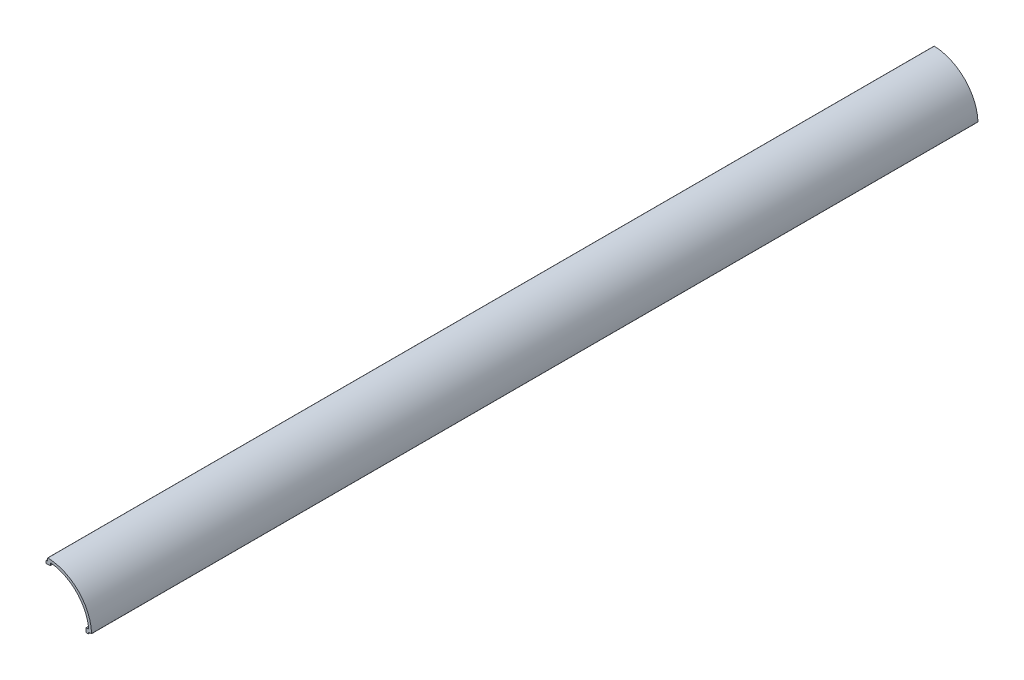
from build123d import *

# Parameters (mm, degrees)
EXTRUDE_THIN1_DEPTH = 150
FILLET1_R           = 0.1


with BuildPart() as part:
    # Sketch1 → Extrude-Thin1 (new, symmetric)
    with BuildSketch(Plane.XY):
        with BuildLine():
            Line((14.416629547, 0), (14.416629547, 0.55))
            Line((14.416629547, 0.55), (15.440207252, 0.55))
            ThreePointArc((15.440207252, 0.55), (10.924799769, 10.924799769), (0.55, 15.440207252))
            Line((0.55, 15.440207252), (0.55, 14.416629547))
            Line((0.55, 14.416629547), (0, 14.416629547))
            Line((0, 14.416629547), (0, 13.516629547))
            Line((0, 13.516629547), (1.45, 13.516629547))
            Line((1.45, 13.516629547), (1.45, 14.477568857))
            ThreePointArc((1.45, 14.477568857), (10.288403666, 10.288403666), (14.477568857, 1.45))
            Line((14.477568857, 1.45), (13.516629547, 1.45))
            Line((13.516629547, 1.45), (13.516629547, 0))
            Line((13.516629547, 0), (14.416629547, 0))
        make_face()
    extrude(amount=EXTRUDE_THIN1_DEPTH, both=True)

    # Fillet1
    fillet1_edges = [part.edges().sort_by_distance(p)[0] for p in [
        (13.516629547, 1.45, 0),
        (14.477568857, 1.45, 0),
        (1.45, 14.477568857, 0),
        (1.45, 13.516629547, 0),
        (0, 13.516629547, 0),
        (0, 14.416629547, 0),
        (0.55, 14.416629547, 0),
        (0.55, 15.440207252, 0),
        (15.440207252, 0.55, 0),
        (14.416629547, 0.55, 0),
        (14.416629547, 0, 0),
        (13.516629547, 0, 0),
    ]]
    fillet(fillet1_edges, radius=FILLET1_R)


solid = part.part
